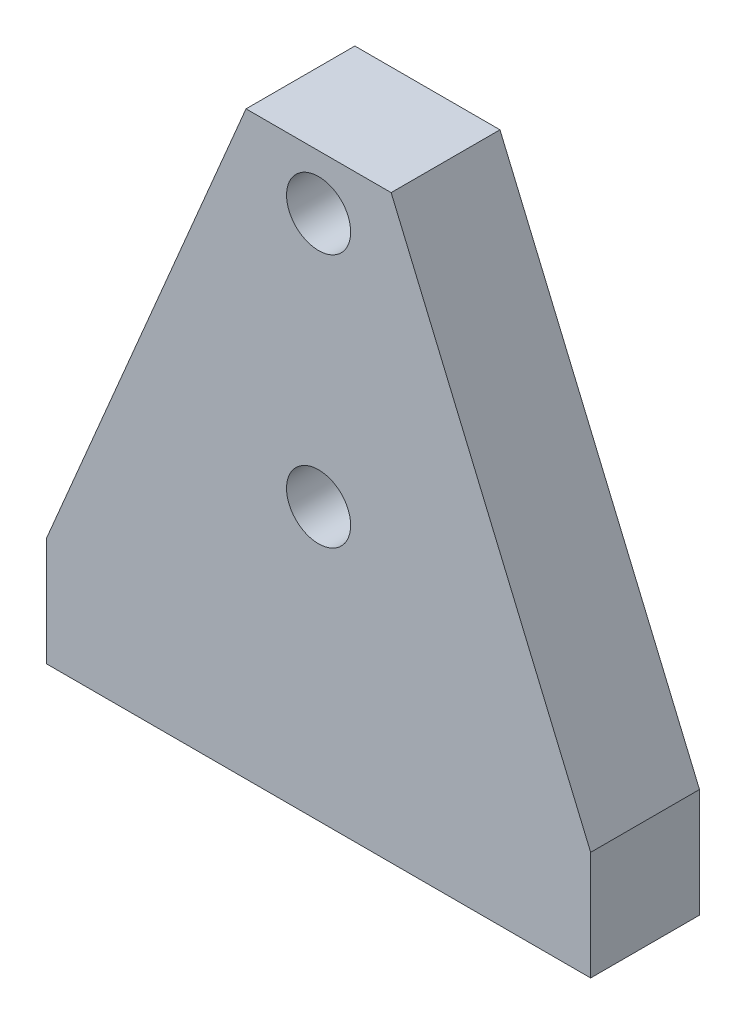
from build123d import *

# Parameters (mm, degrees)
BOSS_EXTRUDE1_DEPTH       = 9.525
F_10_CLEARANCE_HOLE1_D    = 5.6134
M6X1_0_TAPPED_HOLE1_D     = 5
M6X1_0_TAPPED_HOLE1_DEPTH = 13.0048


with BuildPart() as part:
    # Sketch1 → Boss-Extrude1 (new body)
    with BuildSketch(Plane.XY):
        Polygon((23.8125, -25.4), (23.8125, -15.875), (6.35, 25.4), (-6.35, 25.4), (-23.8125, -15.875), (-23.8125, -25.4), align=None)
    extrude(amount=BOSS_EXTRUDE1_DEPTH)

    # #10 Clearance Hole1 (through all)
    with Locations(Plane.XY.offset(9.525)):
        with Locations((0, 20.6375), (0, -1.5875)):
            Hole(F_10_CLEARANCE_HOLE1_D / 2)

    # M6x1.0 Tapped Hole1
    with Locations(Plane(origin=(0, -25.4, 0), x_dir=(-1, 0, 0), z_dir=(0, -1, 0))):
        with Locations((13.9954, -4.7625), (-13.9954, -4.7625)):
            Hole(M6X1_0_TAPPED_HOLE1_D / 2, depth=M6X1_0_TAPPED_HOLE1_DEPTH)


solid = part.part
